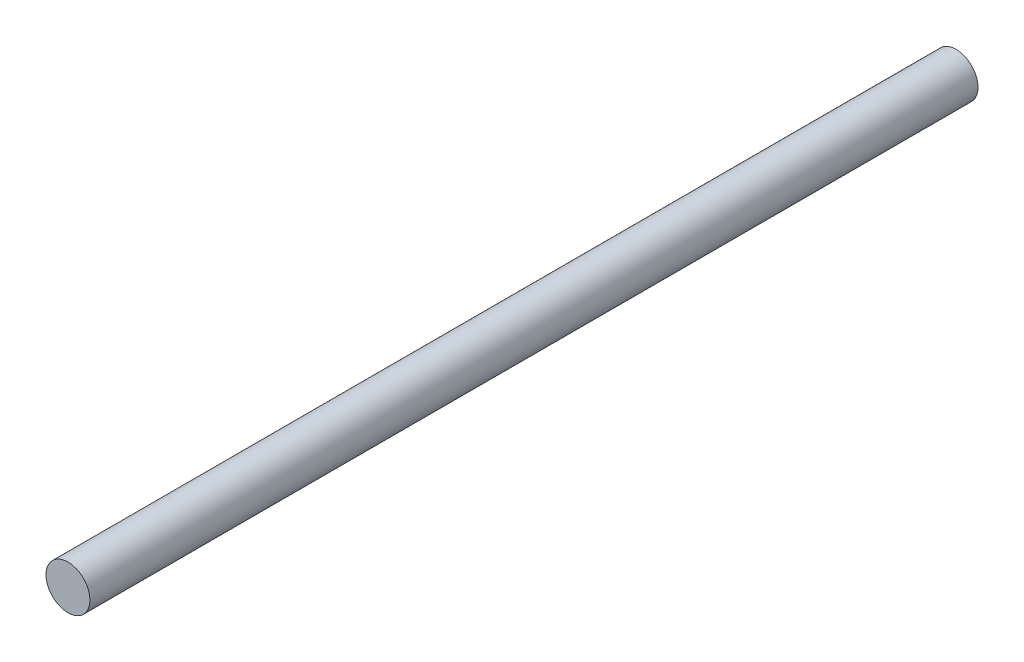
from build123d import *

# Parameters (mm, degrees)
SKETCH1_R           = 2.5
BOSS_EXTRUDE1_DEPTH = 101.12


with BuildPart() as part:
    # Sketch1 → Boss-Extrude1 (new body)
    with BuildSketch(Plane.XY):
        with Locations(Location((0, 0, 0), (0, 0, 180))):
            Circle(SKETCH1_R)
    extrude(amount=BOSS_EXTRUDE1_DEPTH)


solid = part.part
